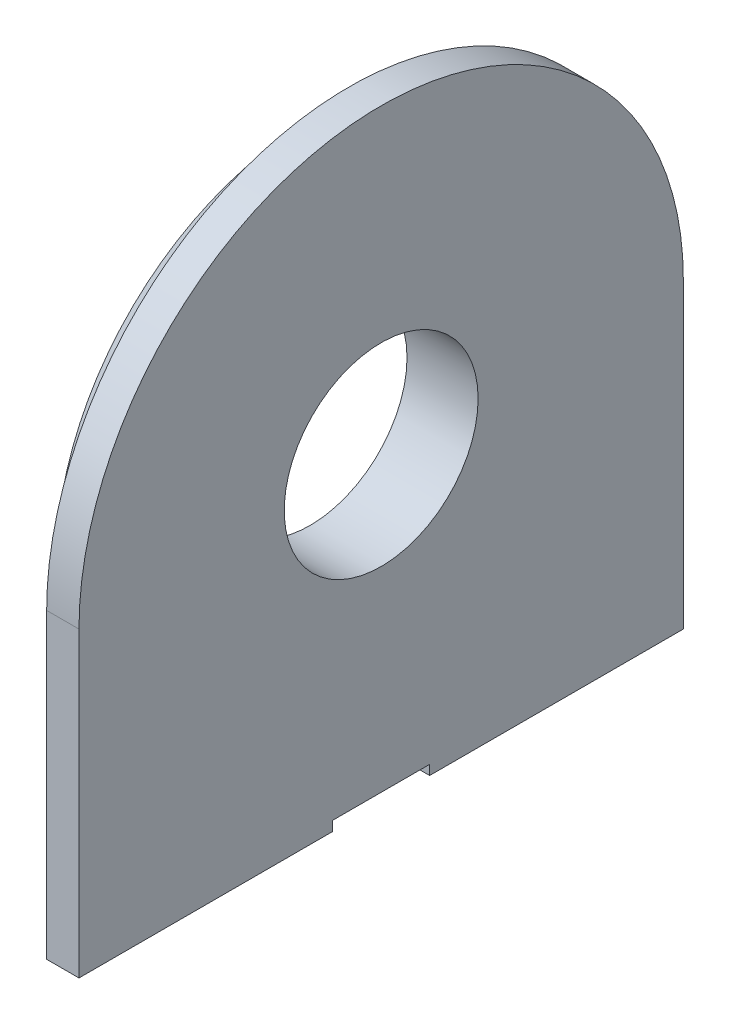
from build123d import *

# Parameters (mm, degrees)
SKETCH_1_R      = 3
EXTRUDE_1_DEPTH = 1.2
CHAMFER_1_SIZE  = 0.5
EXTRUDE_START   = 1
SKETCH_2_R      = 3
EXTRUDE_2_DEPTH = 1


with BuildPart() as part:
    # Эскиз1 → Бобышка-Вытянуть1 (new body)
    with BuildSketch(Plane(origin=(18.5, 0, 0), x_dir=(0, 0, -1), z_dir=(1, 0, 0))):
        with BuildLine():
            Line((1.3, -9.05), (-1.3, -9.05))
            Line((-1.3, -9.05), (-1.3, -8.417392708))
            Line((-1.3, -8.417392708), (-1.3, -8.248181618))
            ThreePointArc((-1.3, -8.248181618), (0, 8.35), (1.3, -8.248181618))
            Line((1.3, -8.248181618), (1.3, -8.417392708))
            Line((1.3, -8.417392708), (1.3, -9.05))
        make_face()
        Circle(SKETCH_1_R, mode=Mode.SUBTRACT)
    extrude(amount=-EXTRUDE_1_DEPTH)

    # Фаска1
    chamfer_1_edges = [part.edges().sort_by_distance(p)[0] for p in [
        (17.3, 8.35, 0),
    ]]
    chamfer(chamfer_1_edges, length=CHAMFER_1_SIZE)

    # Эскиз2 → Бобышка-Вытянуть2 (add)
    with BuildSketch(Plane(origin=(18.5, 0, 0), x_dir=(0, 0, -1), z_dir=(1, 0, 0)).offset(EXTRUDE_START)):
        with BuildLine():
            Line((1.5, -9.05), (-1.5, -9.05))
            Line((-1.5, -9.05), (-1.5, -9.35))
            Line((-1.5, -9.35), (-9.35, -9.35))
            Line((-9.35, -9.35), (-9.35, 0))
            ThreePointArc((-9.35, 0), (0, 9.35), (9.35, 0))
            Line((9.35, 0), (9.35, -9.35))
            Line((9.35, -9.35), (1.5, -9.35))
            Line((1.5, -9.35), (1.5, -9.05))
        make_face()
        Circle(SKETCH_2_R, mode=Mode.SUBTRACT)
    extrude(amount=-EXTRUDE_2_DEPTH)


solid = part.part
